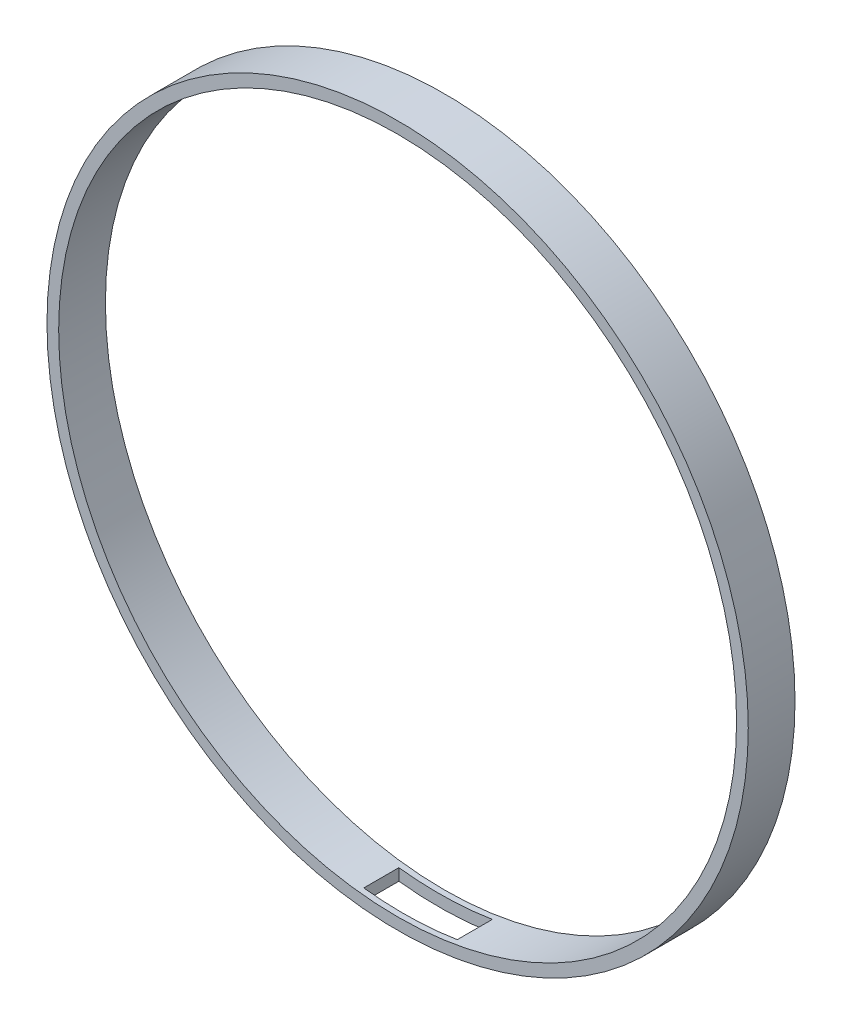
from build123d import *

# Parameters (mm, degrees)
SKETCH1_R               = 190.5
BOSS_EXTRUDE1_DEPTH     = 25.4
SKETCH2_R               = 184.15
CUT_EXTRUDE1_DEPTH      = 25.4
CUT_EXTRUDE2_REACH      = 272.602
CUT_EXTRUDE2_END_RADIUS = 190.5
SKETCH3_W               = 50.8
SKETCH3_H               = 19.05


with BuildPart() as part:
    # Sketch1 → Boss-Extrude1 (new body)
    with BuildSketch(Plane.XY):
        Circle(SKETCH1_R)
    extrude(amount=BOSS_EXTRUDE1_DEPTH)

    # Sketch2 → Cut-Extrude1 (cut)
    with BuildSketch(Plane.XY.offset(25.4)):
        Circle(SKETCH2_R)
    extrude(amount=-CUT_EXTRUDE1_DEPTH, mode=Mode.SUBTRACT)

    # Cut-Extrude2: up to this cylinder (the profile starts inside it)
    cut_extrude2_end = Plane(origin=(0, 0, 12.7), z_dir=(0, 0, -1)) * Cylinder(CUT_EXTRUDE2_END_RADIUS, 927.204, mode=Mode.PRIVATE)
    # Sketch3 → Cut-Extrude2 (cut, up to the surface)
    with BuildSketch(Plane(origin=(0, 0, 0), x_dir=(1, 0, 0), z_dir=(0, 1, 0)), mode=Mode.PRIVATE) as cut_extrude2_sk1:
        with Locations((3.83525529, -12.7)):
            Rectangle(SKETCH3_W, SKETCH3_H)
    cut_extrude2_tool1 = extrude(cut_extrude2_sk1.sketch, amount=-CUT_EXTRUDE2_REACH, mode=Mode.PRIVATE) & cut_extrude2_end
    add(cut_extrude2_tool1.solids().sort_by_distance((3.835255, 0, 12.7))[0], mode=Mode.SUBTRACT)


solid = part.part
